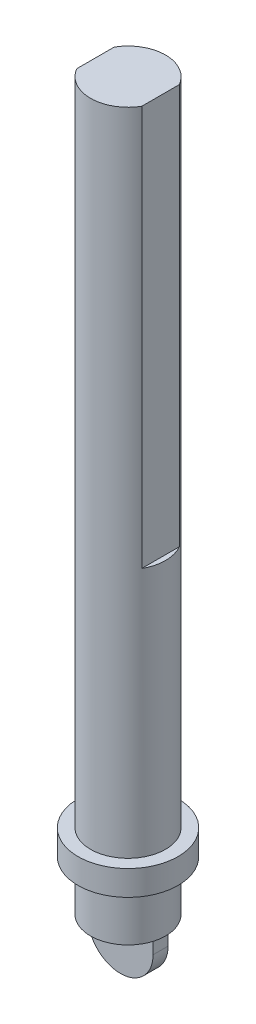
from build123d import *

# Parameters (mm, degrees)
SKETCH3_R                = 7.5
BOSS_EXTRUDE1_DEPTH      = 130
SKETCH4_R                = 10
BOSS_EXTRUDE2_DEPTH      = 5
BOSS_EXTRUDE3_START      = 10
SKETCH5_R                = 7.5
BOSS_EXTRUDE3_DEPTH      = 10
BOSS_EXTRUDE4_DEPTH      = 1.5
BOSS_EXTRUDE4_DEPTH_BACK = 1.5
CUT_EXTRUDE1_START       = -80
CUT_EXTRUDE1_DEPTH       = 80


with BuildPart() as part:
    # Sketch3 → Boss-Extrude1 (new body)
    with BuildSketch(Plane(origin=(0, 0, 0), x_dir=(1, 0, 0), z_dir=(0, 1, 0))):
        Circle(SKETCH3_R)
    extrude(amount=BOSS_EXTRUDE1_DEPTH)

    # Sketch4 → Boss-Extrude2 (add)
    with BuildSketch(Plane.XZ):
        Circle(SKETCH4_R)
    extrude(amount=BOSS_EXTRUDE2_DEPTH)

    # Sketch5 → Boss-Extrude3 (add)
    with BuildSketch(Plane.XZ.offset(5).offset(BOSS_EXTRUDE3_START)):
        Circle(SKETCH5_R)
    extrude(amount=-BOSS_EXTRUDE3_DEPTH)

    # Sketch7 → Boss-Extrude4 (add, two sides: drawn at the far end of the back side and taken through both)
    with BuildSketch(Plane.XY.offset(-BOSS_EXTRUDE4_DEPTH_BACK)):
        with BuildLine():
            Line((-6.5, -15), (6.5, -15))
            Line((6.5, -15), (6.5, -18))
            ThreePointArc((6.5, -18), (0, -24.5), (-6.5, -18))
            Line((-6.5, -18), (-6.5, -15))
        make_face()
    extrude(amount=BOSS_EXTRUDE4_DEPTH + BOSS_EXTRUDE4_DEPTH_BACK)

    # Sketch8 → Cut-Extrude1 (cut)
    with BuildSketch(Plane(origin=(0, 130, 0), x_dir=(1, 0, 0), z_dir=(0, 1, 0)).offset(CUT_EXTRUDE1_START)):
        with BuildLine():
            Line((6.5, 3.741657387), (6.5, -3.741657387))
            ThreePointArc((6.5, -3.741657387), (7.5, 0), (6.5, 3.741657387))
        make_face()
        with BuildLine():
            Line((-6.5, 3.741657387), (-6.5, -3.741657387))
            ThreePointArc((-6.5, -3.741657387), (-7.5, 0), (-6.5, 3.741657387))
        make_face()
    extrude(amount=CUT_EXTRUDE1_DEPTH, mode=Mode.SUBTRACT)


solid = part.part
